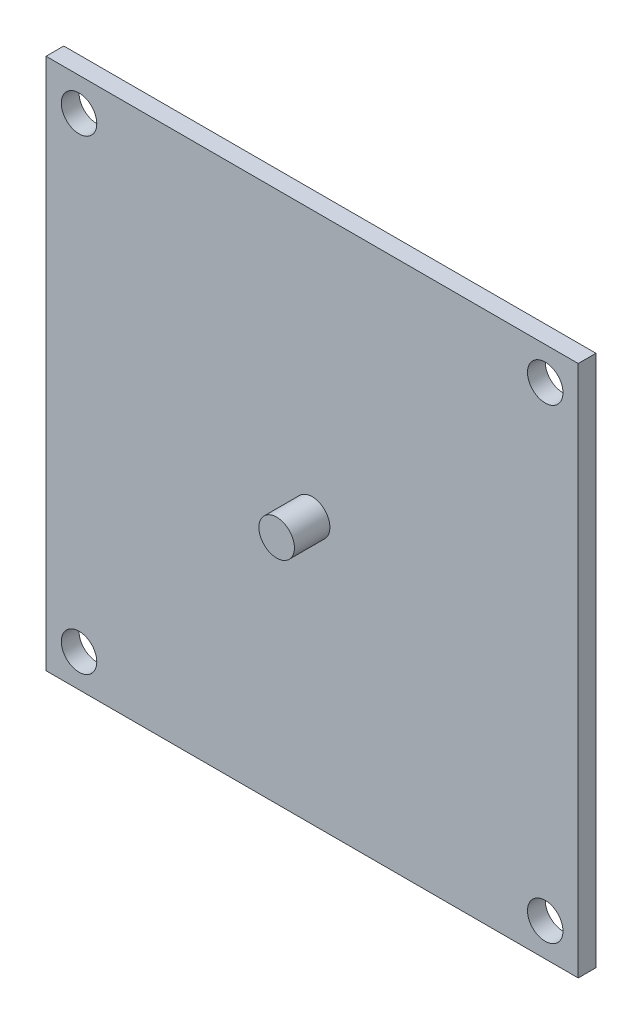
from build123d import *

# Parameters (mm, degrees)
SKETCH1_W           = 30
SKETCH1_H           = 30
BOSS_EXTRUDE1_DEPTH = 1
SKETCH2_R           = 1
CUT_EXTRUDE1_DEPTH  = 22.236760582
SKETCH3_R           = 1
BOSS_EXTRUDE2_DEPTH = 2


with BuildPart() as part:
    # Sketch1 → Boss-Extrude1 (new body)
    with BuildSketch(Plane.XY):
        Rectangle(SKETCH1_W, SKETCH1_H)
    extrude(amount=BOSS_EXTRUDE1_DEPTH)

    # Sketch2 → Cut-Extrude1 (cut, through all)
    with BuildSketch(Plane.XY.offset(1)):
        with Locations((-13.14, 13.14)):
            Circle(SKETCH2_R)
        with Locations((13.14, 13.14)):
            Circle(SKETCH2_R)
        with Locations((13.14, -13.14)):
            Circle(SKETCH2_R)
        with Locations((-13.14, -13.14)):
            Circle(SKETCH2_R)
    extrude(amount=-CUT_EXTRUDE1_DEPTH, mode=Mode.SUBTRACT)

    # Sketch3 → Boss-Extrude2 (add)
    with BuildSketch(Plane.XY.offset(1)):
        Circle(SKETCH3_R)
    extrude(amount=BOSS_EXTRUDE2_DEPTH)


solid = part.part
